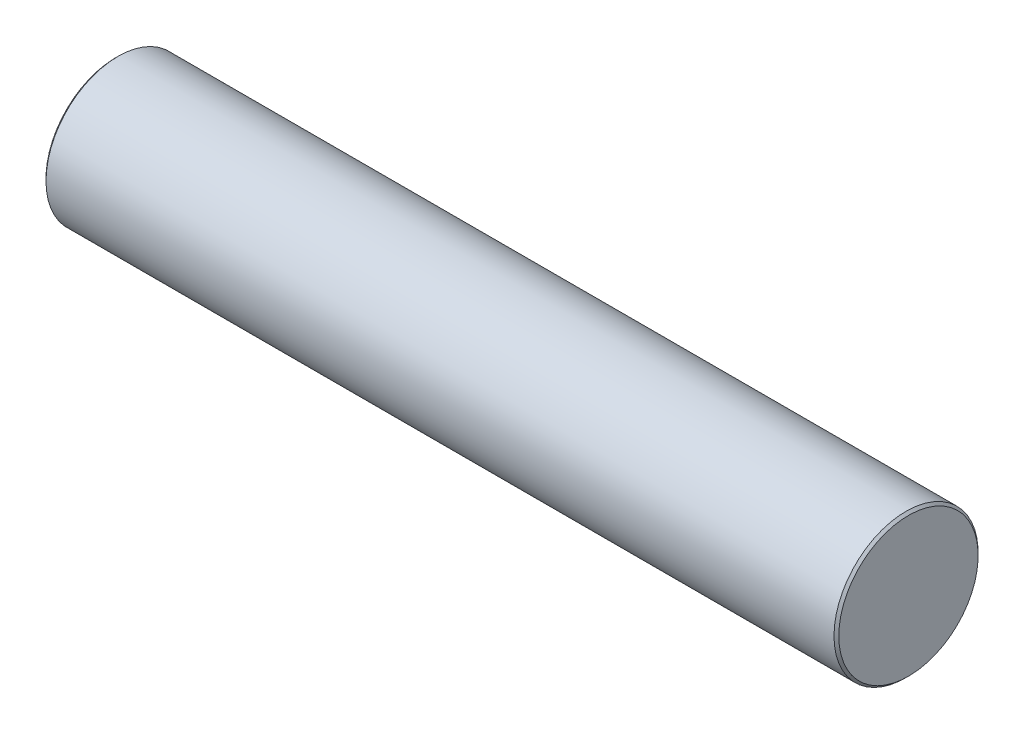
from build123d import *

# Parameters (mm, degrees)
SKETCH_1_R      = 30
EXTRUDE_1_DEPTH = 165
CHAMFER_1_SIZE  = 1


with BuildPart() as part:
    # 草图1 → 凸台-拉伸1 (new, symmetric)
    with BuildSketch(Plane(origin=(0, 0, 0), x_dir=(0, -1, 0), z_dir=(1, 0, 0))):
        with Locations(Location((0, 0, 0), (0, 0, 90))):
            Circle(SKETCH_1_R)
    extrude(amount=EXTRUDE_1_DEPTH, both=True)

    # 倒角1
    chamfer_1_edges = [part.edges().sort_by_distance(p)[0] for p in [
        (-165, 0, 30),
        (165, 0, 30),
    ]]
    chamfer(chamfer_1_edges, length=CHAMFER_1_SIZE)


solid = part.part
